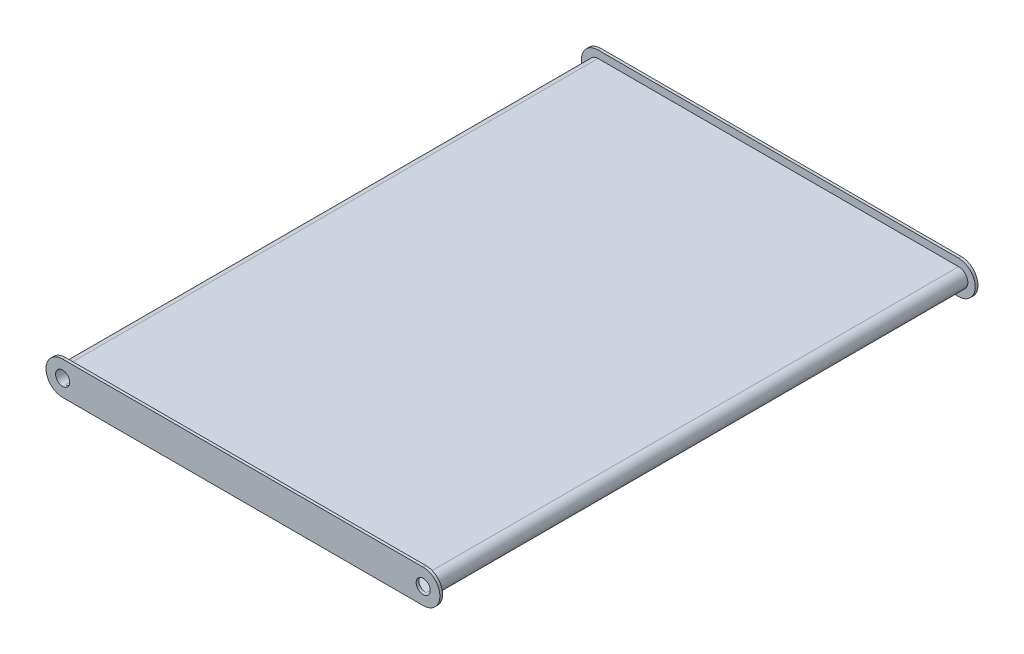
from build123d import *

# Parameters (mm, degrees)
BOSS_EXTRUDE1_DEPTH = 960
SKETCH2_R           = 12.7
BOSS_EXTRUDE2_DEPTH = 5


with BuildPart() as part:
    # Sketch1 → Boss-Extrude1 (new body)
    with BuildSketch(Plane.XY):
        with BuildLine():
            Line((-324.9668, 16.7), (324.9668, 16.7))
            ThreePointArc((324.9668, 16.7), (341.6668, 0), (324.9668, -16.7))
            Line((324.9668, -16.7), (-324.9668, -16.7))
            ThreePointArc((-324.9668, -16.7), (-341.6668, 0), (-324.9668, 16.7))
        make_face()
        with BuildLine():
            Line((-324.9668, 12.7), (324.9668, 12.7))
            ThreePointArc((324.9668, 12.7), (337.6668, 0), (324.9668, -12.7))
            Line((324.9668, -12.7), (-324.9668, -12.7))
            ThreePointArc((-324.9668, -12.7), (-337.6668, 0), (-324.9668, 12.7))
        make_face(mode=Mode.SUBTRACT)
    extrude(amount=BOSS_EXTRUDE1_DEPTH)

    # Sketch2 → Boss-Extrude2 (add)
    with BuildSketch(Plane.XY.offset(960)):
        with BuildLine():
            Line((-324.9668, 30), (324.9668, 30))
            ThreePointArc((324.9668, 30), (354.9668, 0), (324.9668, -30))
            Line((324.9668, -30), (-324.9668, -30))
            ThreePointArc((-324.9668, -30), (-354.9668, 0), (-324.9668, 30))
        make_face()
        with Locations(Location((324.9668, 0, 0), (0, 0, 90))):
            Circle(SKETCH2_R, mode=Mode.SUBTRACT)
        with Locations(Location((-324.9668, 0, 0), (0, 0, 270))):
            Circle(SKETCH2_R, mode=Mode.SUBTRACT)
    boss_extrude2 = extrude(amount=BOSS_EXTRUDE2_DEPTH)

    # Mirror1: Boss-Extrude2 across plane
    add(boss_extrude2.mirror(Plane.XY.offset(480)))


solid = part.part
